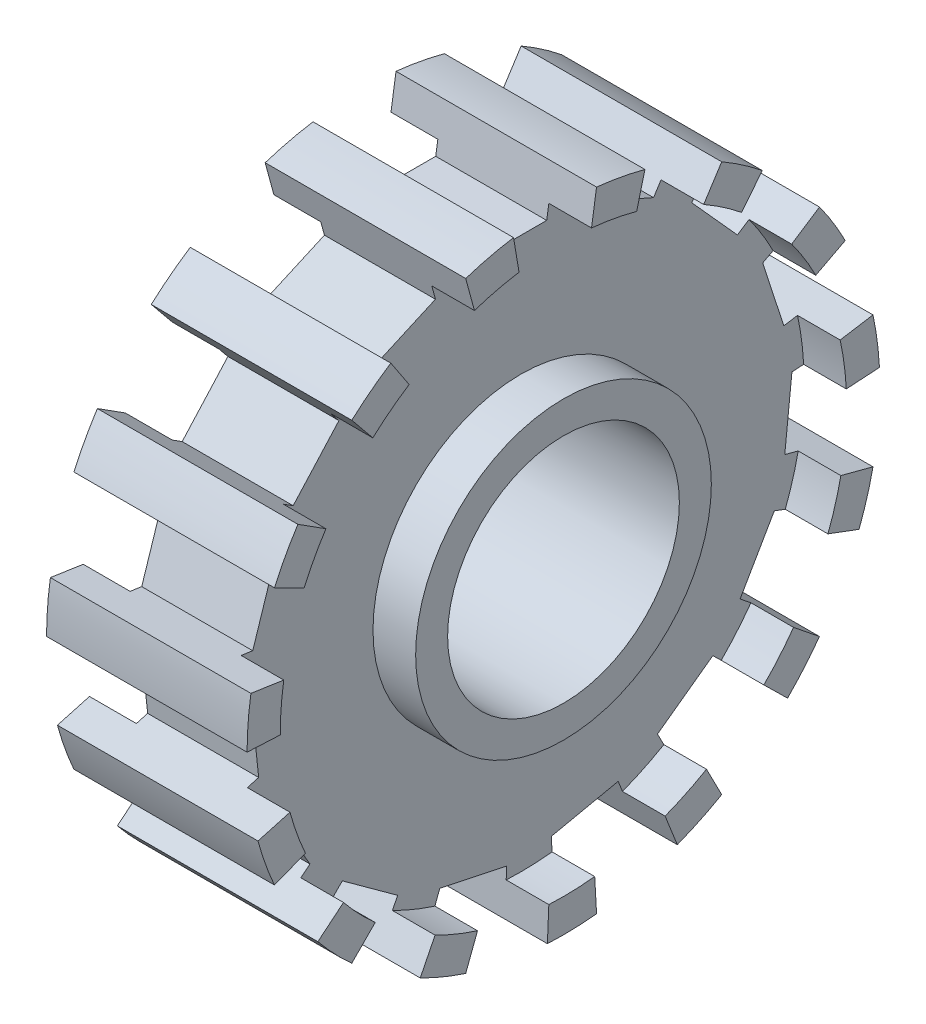
from build123d import *

# Parameters (mm, degrees)
CUT_EXTRUDE3_DEPTH = 16
CIRPATTERN1_COUNT  = 15


with BuildPart() as part:
    # Sketch1 → Revolve1 (revolve)
    with BuildSketch(Plane.XY, mode=Mode.PRIVATE) as revolve1_sk:
        Polygon((0, 5.778414329), (-10, 5.778414329), (-10, 7.373034886), (-7.662379617, 7.373034886), (-7.662379617, 14.122184027), (-10, 14.122184027), (-10, 15.778414329), (0, 15.778414329), (0, 14.122184027), (-2.126486554, 14.122184027), (-2.126486554, 7.373034886), (0, 7.373034886), align=None)
    revolve(revolve1_sk.sketch.rotate(Axis((0, 0, 0), (-1, 0, 0)), 90), axis=Axis((0, 0, 0), (-1, 0, 0)))

    # Sketch2 → Cut-Extrude3 (cut)
    with BuildSketch(Plane(origin=(0, 0, 0), x_dir=(0, 0, -1), z_dir=(1, 0, 0))):
        Polygon((-2.776343501, 17.284448499), (-2.119655167, 13.369575739), (1.290072721, 13.369575739), (1.896246568, 17.284448499), align=None)
    cut_extrude3 = extrude(amount=-CUT_EXTRUDE3_DEPTH, mode=Mode.SUBTRACT)

    # CirPattern1: Cut-Extrude3 ×15 about axis
    cirpattern1_axis = Axis((0, 0, 0), (1, 0, 0))
    for i in range(1, CIRPATTERN1_COUNT):
        add(cut_extrude3.rotate(cirpattern1_axis, i * 360 / CIRPATTERN1_COUNT), mode=Mode.SUBTRACT)


solid = part.part
